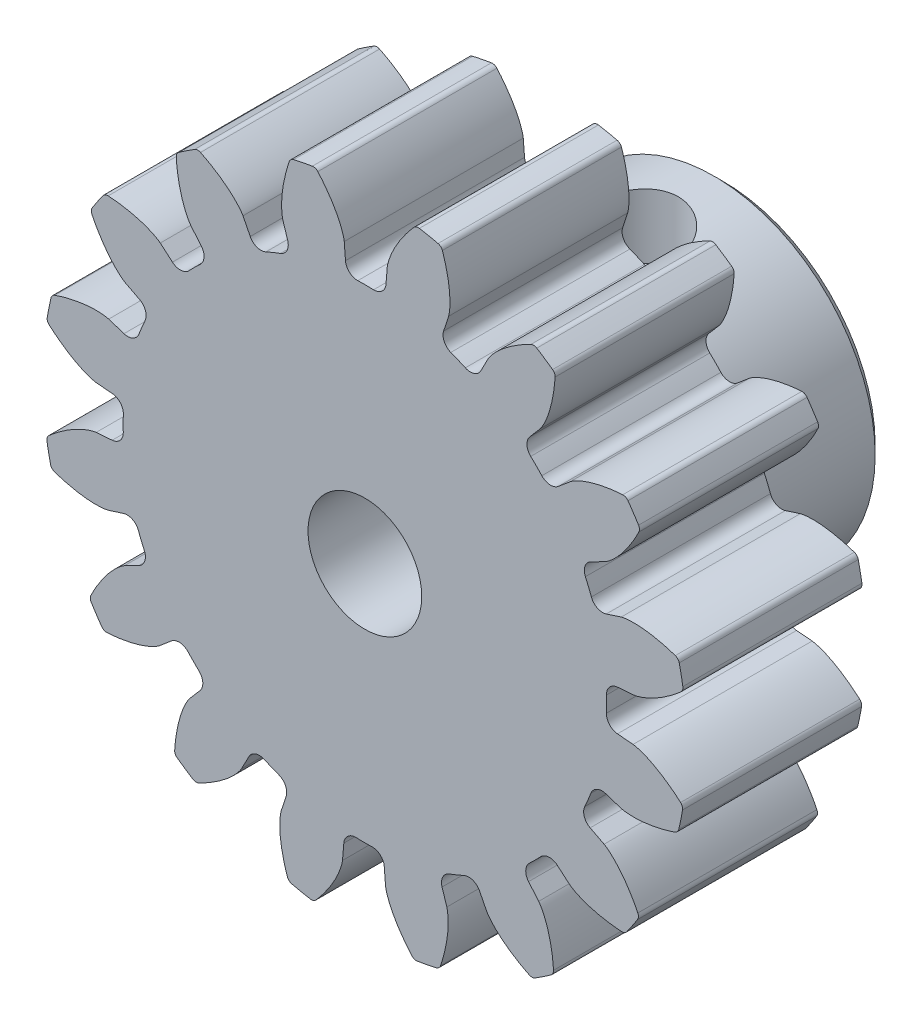
from build123d import *

# Parameters (mm, degrees)
SKETCH1_R                            = 9
BOSS_EXTRUDE1_DEPTH                  = 5
CUT_DRLTDB_DEPTH                     = 14.674794331
FILLET_DRLTDB_R                      = 0.167752518
CIRPATTERN_DRLTDB_COUNT              = 16
FILLET_DRLTDB_OF_CIRPATTERN_DRLTDB_R = 0.167752518
SKETCH4_R                            = 4.5
BOSS_EXTRUDE2_DEPTH                  = 5
CUT_EXTRUDE1_DEPTH                   = 14.519464336
CUT_EXTRUDE1_DEPTH_BACK              = 14.519464336
SKETCH3_R                            = 1.5875
SKETCH5_R                            = 1.25
CUT_EXTRUDE2_DEPTH                   = 14.519464336
CHAMFER1_SIZE                        = 0.25


with BuildPart() as part:
    # Sketch1 → Boss-Extrude1 (new body)
    with BuildSketch(Plane.XY):
        Circle(SKETCH1_R)
    extrude(amount=BOSS_EXTRUDE1_DEPTH)

    # DrLTDb → Cut - DrLTDb (cut, through all)
    with BuildSketch(Plane.XY):
        with BuildLine():
            ThreePointArc((6.745650303, -0.242284925), (6.829994574, -0.477016706), (7.053033781, -0.588670083))
            Line((7.053033781, -0.588670083), (7.489832095, -0.62512675))
            add(Edge.make_bspline(
                [(7.489832095, -0.62512675), (7.493012111, -0.625443606), (7.501914838, -0.626490217), (7.518676448, -0.629091978), (7.545900769, -0.634218793), (7.580382093, -0.642042817), (7.624672472, -0.653631272), (7.676453677, -0.669171863), (7.732900148, -0.68821809), (7.793767153, -0.711048418), (7.853972289, -0.735678503), (7.913512588, -0.761960845), (7.972335143, -0.789679393), (8.042973674, -0.825056487), (8.126798157, -0.869972466), (8.223401276, -0.926062668), (8.331267882, -0.99388211), (8.439257617, -1.067423867), (8.54387855, -1.143401505), (8.647574065, -1.224240402), (8.744630008, -1.303829353), (8.818117593, -1.368284585), (8.8638728, -1.409388253), (8.885765209, -1.429397303)],
                knots=[0, 0, 0, 0, 0, 0.005376749, 0.015083688, 0.02853182, 0.046610139, 0.064854849, 0.092110525, 0.119476176, 0.146842496, 0.174208854, 0.201574956, 0.228941013, 0.256307345, 0.307035032, 0.361767352, 0.416499661, 0.471231937, 0.525964282, 0.580696615, 0.635428982, 0.68608525, 0.68608525, 0.68608525, 0.68608525, 0.68608525], degree=4))
            ThreePointArc((8.885765209, -1.429397303), (8.971395847, -0.716977377), (9, 0))
            ThreePointArc((9, 0), (8.973521278, 0.689866559), (8.894240918, 1.375673832))
            add(Edge.make_bspline(
                [(7.503736197, 0.576356848), (7.506916213, 0.576673704), (7.515818939, 0.577720316), (7.53258055, 0.580322076), (7.559804871, 0.585448891), (7.594286195, 0.593272915), (7.638576574, 0.60486137), (7.690357778, 0.620401962), (7.74680425, 0.639448188), (7.807671255, 0.662278516), (7.86787639, 0.686908601), (7.92741669, 0.713190943), (7.986239245, 0.740909491), (8.056877776, 0.776286585), (8.140702259, 0.821202565), (8.237305378, 0.877292767), (8.345171984, 0.945112209), (8.453161719, 1.018653965), (8.557782652, 1.094631604), (8.661478167, 1.175470501), (8.75711633, 1.253896827), (8.829141264, 1.316989872), (8.873682166, 1.356942647), (8.894240918, 1.375673832)],
                knots=[0, 0, 0, 0, 0, 0.005376749, 0.015083688, 0.02853182, 0.046610139, 0.064854849, 0.092110525, 0.119476176, 0.146842496, 0.174208854, 0.201574956, 0.228941013, 0.256307345, 0.307035032, 0.361767352, 0.416499661, 0.471231937, 0.525964282, 0.580696615, 0.635428982, 0.682946703, 0.682946703, 0.682946703, 0.682946703, 0.682946703], degree=4))
            Line((7.503736197, 0.576356848), (7.056771642, 0.542025806))
            ThreePointArc((7.056771642, 0.542025806), (6.832999109, 0.431849501), (6.747104744, 0.197680497))
            ThreePointArc((6.747104744, 0.197680497), (6.749963117, -0.022314067), (6.745650303, -0.242284925))
        make_face()
    cut_drltdb = extrude(amount=CUT_DRLTDB_DEPTH, mode=Mode.SUBTRACT)

    # Fillet - DrLTDb
    fillet_drltdb_edges = [part.edges().sort_by_distance(p)[0] for p in [
        (8.885765209, -1.429397303, 2.5),
        (8.894240918, 1.375673832, 2.5),
    ]]
    fillet(fillet_drltdb_edges, radius=FILLET_DRLTDB_R)

    # CirPattern - DrLTDb: Cut - DrLTDb ×16 about axis
    cirpattern_drltdb_axis = Axis((0, 0, 5), (0, 0, 1))
    for i in range(1, CIRPATTERN_DRLTDB_COUNT):
        add(cut_drltdb.rotate(cirpattern_drltdb_axis, i * 360 / CIRPATTERN_DRLTDB_COUNT), mode=Mode.SUBTRACT)

    # Fillet - DrLTDb of CirPattern - DrLTDb
    fillet_drltdb_of_cirpattern_drltdb_edges = [part.edges().sort_by_distance(p)[0] for p in [
        (8.756383273, 2.079844217, 2.5),
        (7.690759558, 4.674635539, 2.5),
        (7.293921361, 5.272448309, 2.5),
        (5.316429772, 7.261926362, 2.5),
        (4.721026042, 7.662369941, 2.5),
        (2.132721746, 8.743654725, 2.5),
        (1.429397303, 8.885765209, 2.5),
        (-1.375673832, 8.894240918, 2.5),
        (-2.079844217, 8.756383273, 2.5),
        (-4.674635539, 7.690759558, 2.5),
        (-5.272448309, 7.293921361, 2.5),
        (-7.261926362, 5.316429772, 2.5),
        (-7.662369941, 4.721026042, 2.5),
        (-8.743654725, 2.132721746, 2.5),
        (-8.885765209, 1.429397303, 2.5),
        (-8.894240918, -1.375673832, 2.5),
        (-8.756383273, -2.079844217, 2.5),
        (-7.690759558, -4.674635539, 2.5),
        (-7.293921361, -5.272448309, 2.5),
        (-5.316429772, -7.261926362, 2.5),
        (-4.721026042, -7.662369941, 2.5),
        (-2.132721746, -8.743654725, 2.5),
        (-1.429397303, -8.885765209, 2.5),
        (1.375673832, -8.894240918, 2.5),
        (2.079844217, -8.756383273, 2.5),
        (4.674635539, -7.690759558, 2.5),
        (5.272448309, -7.293921361, 2.5),
        (7.261926362, -5.316429772, 2.5),
        (7.662369941, -4.721026042, 2.5),
        (8.743654725, -2.132721746, 2.5),
    ]]
    fillet(fillet_drltdb_of_cirpattern_drltdb_edges, radius=FILLET_DRLTDB_OF_CIRPATTERN_DRLTDB_R)

    # Sketch4 → Boss-Extrude2 (add)
    with BuildSketch(Plane.XY):
        Circle(SKETCH4_R)
    extrude(amount=-BOSS_EXTRUDE2_DEPTH)

    # Sketch3 → Cut-Extrude1 (cut, two sides: drawn at the far end of the back side and taken through both)
    with BuildSketch(Plane.XY.offset(-CUT_EXTRUDE1_DEPTH_BACK)):
        with Locations(Location((0, 0, 0), (0, 0, 180))):
            Circle(SKETCH3_R)
    extrude(amount=CUT_EXTRUDE1_DEPTH + CUT_EXTRUDE1_DEPTH_BACK, mode=Mode.SUBTRACT)

    # Sketch5 → Cut-Extrude2 (cut, through all)
    with BuildSketch(Plane(origin=(0, 0, 0), x_dir=(1, 0, 0), z_dir=(0, 1, 0))):
        with Locations(Location((0, 2.5, 0), (0, 0, 90))):
            Circle(SKETCH5_R)
    extrude(amount=CUT_EXTRUDE2_DEPTH, mode=Mode.SUBTRACT)

    # Chamfer1
    chamfer1_edges = [part.edges().sort_by_distance(p)[0] for p in [
        (-4.5, 0, -5),
        (-4.5, 0, 0),
    ]]
    chamfer(chamfer1_edges, length=CHAMFER1_SIZE)


solid = part.part
